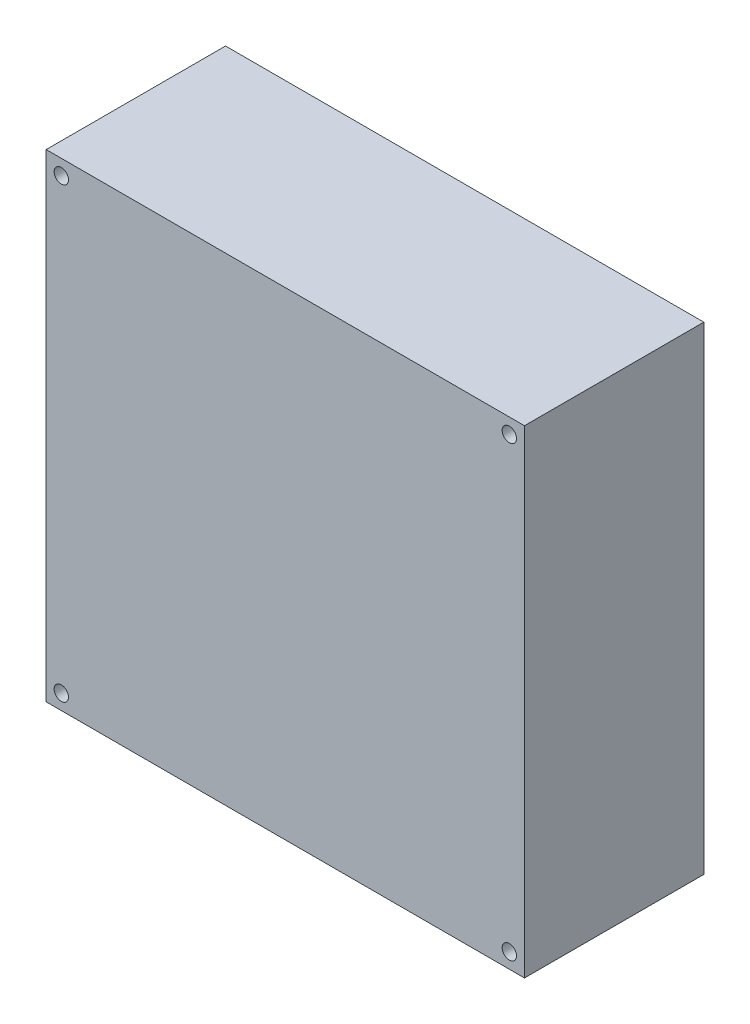
from build123d import *

# Parameters (mm, degrees)
SKETCH_1_W          = 120
SKETCH_1_H          = 120
EXTRUDE_1_DEPTH     = 45
CUT_EXTRUDE_1_REACH = 177.57
SKETCH_2_R          = 1.8


with BuildPart() as part:
    # 草图1 → 凸台-拉伸1 (new body)
    with BuildSketch(Plane.XY):
        with Locations((60, 60)):
            Rectangle(SKETCH_1_W, SKETCH_1_H)
    extrude(amount=EXTRUDE_1_DEPTH)

    # 草图2 → 切除-拉伸1 (cut, up to next)
    with BuildSketch(Plane.XY.offset(45), mode=Mode.PRIVATE) as cut_extrude_1_sk1:
        with Locations((3.8, 116.2)):
            Circle(SKETCH_2_R)
    cut_extrude_1_tool1 = extrude(cut_extrude_1_sk1.sketch, amount=-CUT_EXTRUDE_1_REACH, mode=Mode.PRIVATE) & part.part
    # 草图2 → 切除-拉伸1 (cut, up to next)
    with BuildSketch(Plane.XY.offset(45), mode=Mode.PRIVATE) as cut_extrude_1_sk2:
        with Locations((116.2, 116.2)):
            Circle(SKETCH_2_R)
    cut_extrude_1_tool2 = extrude(cut_extrude_1_sk2.sketch, amount=-CUT_EXTRUDE_1_REACH, mode=Mode.PRIVATE) & part.part
    # 草图2 → 切除-拉伸1 (cut, up to next)
    with BuildSketch(Plane.XY.offset(45), mode=Mode.PRIVATE) as cut_extrude_1_sk3:
        with Locations((116.2, 3.8)):
            Circle(SKETCH_2_R)
    cut_extrude_1_tool3 = extrude(cut_extrude_1_sk3.sketch, amount=-CUT_EXTRUDE_1_REACH, mode=Mode.PRIVATE) & part.part
    # 草图2 → 切除-拉伸1 (cut, up to next)
    with BuildSketch(Plane.XY.offset(45), mode=Mode.PRIVATE) as cut_extrude_1_sk4:
        with Locations((3.8, 3.8)):
            Circle(SKETCH_2_R)
    cut_extrude_1_tool4 = extrude(cut_extrude_1_sk4.sketch, amount=-CUT_EXTRUDE_1_REACH, mode=Mode.PRIVATE) & part.part
    add(cut_extrude_1_tool1.solids().sort_by_distance((3.8, 116.2, 45))[0], mode=Mode.SUBTRACT)
    add(cut_extrude_1_tool2.solids().sort_by_distance((116.2, 116.2, 45))[0], mode=Mode.SUBTRACT)
    add(cut_extrude_1_tool3.solids().sort_by_distance((116.2, 3.8, 45))[0], mode=Mode.SUBTRACT)
    add(cut_extrude_1_tool4.solids().sort_by_distance((3.8, 3.8, 45))[0], mode=Mode.SUBTRACT)


solid = part.part
